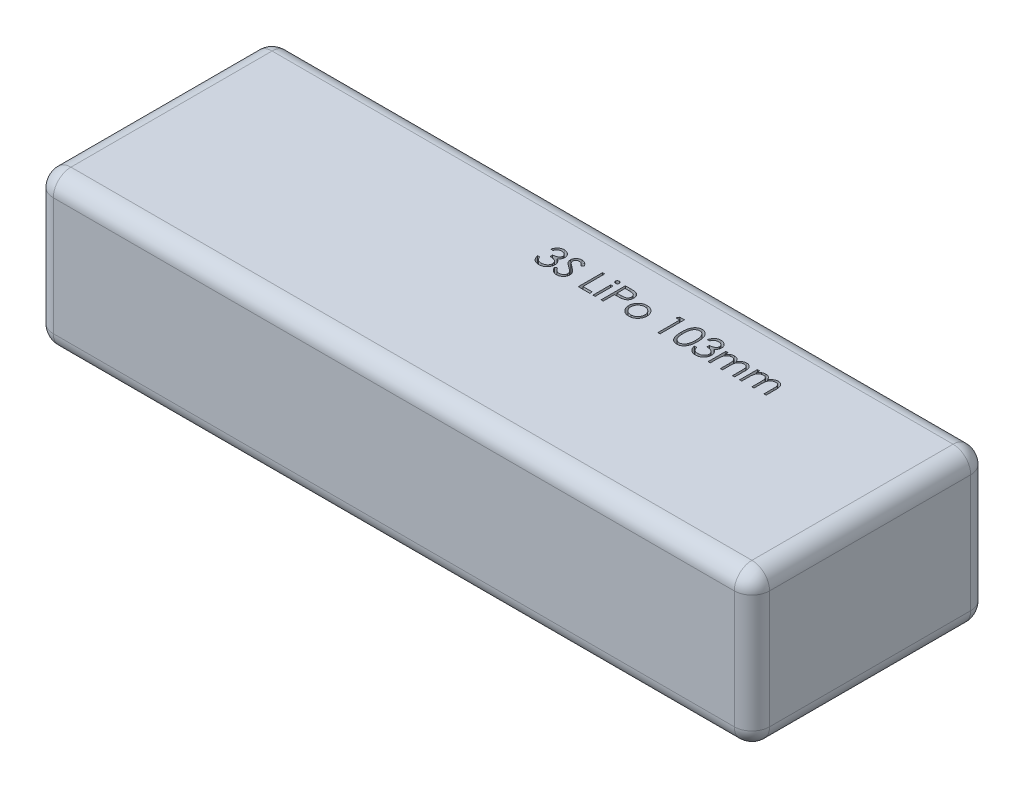
from build123d import *

# Parameters (mm, degrees)
SKETCH1_W           = 103
SKETCH1_H           = 34
BOSS_EXTRUDE1_DEPTH = 22
FILLET1_R           = 2.54
FILLET2_R           = 2.54
SKETCH2_W           = 0.314102564
SKETCH2_H           = 2.557692308
CUT_EXTRUDE1_DEPTH  = 2.54


with BuildPart() as part:
    # Sketch1 → Boss-Extrude1 (new body)
    with BuildSketch(Plane(origin=(0, 0, 0), x_dir=(1, 0, 0), z_dir=(0, 1, 0))):
        with Locations((51.5, 17)):
            Rectangle(SKETCH1_W, SKETCH1_H)
    extrude(amount=BOSS_EXTRUDE1_DEPTH)

    # Fillet1
    fillet1_edges = [part.edges().sort_by_distance(p)[0] for p in [
        (51.5, 22, -34),
        (51.5, 0, -34),
        (51.5, 0, 0),
        (51.5, 22, 0),
    ]]
    fillet(fillet1_edges, radius=FILLET1_R)

    # Fillet2
    fillet2_edges = [part.edges().sort_by_distance(p)[0] for p in [
        (103, 11, 0),
        (0, 11, 0),
        (103, 0, -17),
        (103, 11, -34),
        (103, 22, -17),
        (103, 21.256051224, -0.743948776),
        (103, 21.256051224, -33.256051224),
        (103, 0.743948776, -33.256051224),
        (103, 0.743948776, -0.743948776),
        (0, 0, -17),
        (0, 22, -17),
        (0, 11, -34),
        (0, 21.256051224, -0.743948776),
        (0, 21.256051224, -33.256051224),
        (0, 0.743948776, -33.256051224),
        (0, 0.743948776, -0.743948776),
    ]]
    fillet(fillet2_edges, radius=FILLET2_R)

    # Sketch2 → Cut-Extrude1 (cut)
    # profile 1 of 12: a face of its own
    with BuildSketch(Plane(origin=(0, 22, 0), x_dir=(1, 0, 0), z_dir=(0, 1, 0))):
        with BuildLine():
            Line((47.573333333, 26.822307692), (47.259230769, 26.822307692))
            add(Edge.make_bspline(
                [(47.259230769, 26.822307692), (47.26774032, 26.857540176), (47.284375795, 26.926416801), (47.319073369, 27.024824062), (47.356872624, 27.117947583), (47.402261729, 27.204043657), (47.451770483, 27.284842559), (47.508493204, 27.358511684), (47.569812927, 27.426924649), (47.637637876, 27.487637887), (47.708766538, 27.542615616), (47.784201158, 27.589490673), (47.862424051, 27.629814826), (47.943977184, 27.663035058), (48.029103356, 27.688060582), (48.117032979, 27.706217387), (48.207996479, 27.718008502), (48.26974407, 27.719159265), (48.301097756, 27.71974359)],
                knots=[0, 0, 0, 0, 1.162005537, 2.271625781, 3.343758855, 4.383309926, 5.390229558, 6.379919256, 7.361854164, 8.333198761, 9.295911338, 10.242430842, 11.177959212, 12.116337295, 13.062827104, 14.020064771, 14.994644689, 16, 16, 16, 16], degree=3))
            add(Edge.make_bspline(
                [(48.301097756, 27.71974359), (48.346780498, 27.718364359), (48.437149509, 27.715635984), (48.569912556, 27.690721548), (48.697939375, 27.651296415), (48.819828623, 27.596822688), (48.933047056, 27.529635375), (49.033783243, 27.449670638), (49.120671753, 27.358471337), (49.193566131, 27.257738772), (49.25064113, 27.150083263), (49.292727504, 27.039283106), (49.318349185, 26.925601134), (49.321669741, 26.848843855), (49.323333333, 26.810388622)],
                knots=[0, 0, 0, 0, 1.083050992, 2.142477498, 3.193116406, 4.255571735, 5.30263384, 6.308962982, 7.297363603, 8.282367274, 9.249857812, 10.179914175, 11.08814088, 12, 12, 12, 12], degree=3))
            add(Edge.make_bspline(
                [(49.323333333, 26.810388622), (49.322169742, 26.773381827), (49.319892775, 26.700965273), (49.30055907, 26.595243775), (49.268022807, 26.495602175), (49.222953044, 26.401621013), (49.164611494, 26.313896173), (49.093938797, 26.232230282), (49.010436135, 26.156261124), (48.947157197, 26.112741651), (48.914579327, 26.090336538)],
                knots=[0, 0, 0, 0, 1.024540389, 2.004866551, 2.965041327, 3.920577974, 4.882998113, 5.874504559, 6.905732034, 8, 8, 8, 8], degree=3))
            add(Edge.make_bspline(
                [(48.914579327, 26.090336538), (48.951811081, 26.072358367), (49.025577956, 26.036738409), (49.126128485, 25.966882652), (49.217406361, 25.886226304), (49.26831008, 25.823283652), (49.293886218, 25.791658654)],
                knots=[0, 0, 0, 0, 1.015518401, 2.012035669, 3.001164323, 4, 4, 4, 4], degree=3))
            add(Edge.make_bspline(
                [(49.293886218, 25.791658654), (49.31072756, 25.768600902), (49.344134456, 25.722862986), (49.38536999, 25.64932656), (49.422779104, 25.574975071), (49.451929324, 25.497815664), (49.474503191, 25.418742651), (49.490639223, 25.337620255), (49.500663364, 25.254382232), (49.502098916, 25.198069752), (49.502820513, 25.169763622)],
                knots=[0, 0, 0, 0, 1.025084078, 2.033381695, 3.024893161, 4.013698104, 4.991890475, 5.976764909, 6.982997093, 8, 8, 8, 8], degree=3))
            add(Edge.make_bspline(
                [(49.502820513, 25.169763622), (49.501025999, 25.120753901), (49.497445417, 25.022965099), (49.465441343, 24.878490377), (49.415828102, 24.737264875), (49.345371166, 24.602190036), (49.259503657, 24.475809655), (49.157346333, 24.362733346), (49.040059925, 24.265534741), (48.909254276, 24.184324513), (48.767537148, 24.119406591), (48.615961556, 24.074349148), (48.456711502, 24.045003148), (48.347504204, 24.04185628), (48.291983173, 24.04025641)],
                knots=[0, 0, 0, 0, 0.955779014, 1.907060117, 2.875433937, 3.871313158, 4.872415639, 5.851225146, 6.836215519, 7.83643374, 8.849228613, 9.86973379, 10.916971861, 12, 12, 12, 12], degree=3))
            add(Edge.make_bspline(
                [(48.291983173, 24.04025641), (48.254563873, 24.041124624), (48.180935168, 24.042832978), (48.072691669, 24.054511579), (47.96936997, 24.075841584), (47.870830372, 24.104544889), (47.776985336, 24.140936632), (47.688121231, 24.18625533), (47.603691337, 24.239566832), (47.524492386, 24.301500419), (47.450533818, 24.370781759), (47.383781094, 24.448640769), (47.323121301, 24.533638173), (47.270178662, 24.626761229), (47.22254171, 24.726806487), (47.183360753, 24.835054985), (47.148875184, 24.950539007), (47.13284172, 25.031016747), (47.124615385, 25.072307692)],
                knots=[0, 0, 0, 0, 1.048658725, 2.063410685, 3.046034179, 4.001477787, 4.936774919, 5.862367409, 6.792675028, 7.730719943, 8.675894397, 9.627829632, 10.600096036, 11.597688215, 12.626045268, 13.701542398, 14.82072376, 16, 16, 16, 16], degree=3))
            Line((47.124615385, 25.072307692), (47.438717949, 25.072307692))
            add(Edge.make_bspline(
                [(47.438717949, 25.072307692), (47.44690124, 25.045358679), (47.462818453, 24.992940507), (47.489912751, 24.917500202), (47.520781023, 24.848342149), (47.553895582, 24.784959027), (47.588674028, 24.726726624), (47.627588953, 24.675184755), (47.667758098, 24.628069553), (47.698037451, 24.601524941), (47.712856571, 24.588533654)],
                knots=[0, 0, 0, 0, 1.198163088, 2.33053128, 3.407730985, 4.417276592, 5.372219308, 6.28897303, 7.162600585, 8, 8, 8, 8], degree=3))
            add(Edge.make_bspline(
                [(47.712856571, 24.588533654), (47.732453147, 24.57342532), (47.77158581, 24.543255288), (47.835354041, 24.50475366), (47.902418927, 24.471392634), (47.974233601, 24.445908939), (48.049248372, 24.424331278), (48.128675737, 24.410210759), (48.211814954, 24.400522587), (48.268582718, 24.399667656), (48.297592147, 24.399230769)],
                knots=[0, 0, 0, 0, 0.946170439, 1.889420265, 2.845303464, 3.807233317, 4.801018734, 5.828864929, 6.890507805, 8, 8, 8, 8], degree=3))
            add(Edge.make_bspline(
                [(48.297592147, 24.399230769), (48.33034565, 24.399846674), (48.394392297, 24.401051024), (48.487847156, 24.412126731), (48.576754604, 24.428257144), (48.66012753, 24.453170127), (48.739058037, 24.483950979), (48.812439687, 24.522599384), (48.881235793, 24.567944106), (48.944565198, 24.619483264), (49.001510706, 24.675904759), (49.051650219, 24.73491783), (49.09427488, 24.79627366), (49.128658459, 24.860311781), (49.155809009, 24.92676701), (49.17429221, 24.995825839), (49.187143725, 25.066923105), (49.188190337, 25.115252074), (49.188717949, 25.139615385)],
                knots=[0, 0, 0, 0, 1.217147791, 2.380027433, 3.494444702, 4.572153297, 5.609568379, 6.639424714, 7.649109417, 8.668170816, 9.669597737, 10.625200337, 11.543417969, 12.441394052, 13.322311151, 14.205496177, 15.095365482, 16, 16, 16, 16], degree=3))
            add(Edge.make_bspline(
                [(49.188717949, 25.139615385), (49.187187647, 25.172226723), (49.184134659, 25.237287132), (49.160826079, 25.333004706), (49.122487215, 25.425228118), (49.068814704, 25.512383909), (49.003478975, 25.59315981), (48.927114068, 25.665231293), (48.83908584, 25.724701384), (48.758065971, 25.76579004), (48.686300814, 25.793827115), (48.62488543, 25.81250208), (48.556128827, 25.828315735), (48.480862478, 25.843028007), (48.398519261, 25.855549355), (48.309188823, 25.865991171), (48.212853062, 25.874346212), (48.146161896, 25.878077307), (48.111794872, 25.88)],
                knots=[0, 0, 0, 0, 1.07054697, 2.135767047, 3.216561865, 4.33974944, 5.486079747, 6.621378074, 7.775625952, 8.963672916, 9.598146892, 10.304877434, 11.070270905, 11.915000392, 12.823868403, 13.805723172, 14.86925407, 16, 16, 16, 16], degree=3))
            Line((48.111794872, 25.88), (48.111794872, 26.238974359))
            add(Edge.make_bspline(
                [(48.111794872, 26.238974359), (48.155096038, 26.239709163), (48.239912384, 26.241148463), (48.363806689, 26.258556473), (48.482280001, 26.282637101), (48.592706743, 26.319522293), (48.693355456, 26.36236259), (48.780675058, 26.4122148), (48.853442206, 26.467629549), (48.911303277, 26.529462158), (48.954832506, 26.595777206), (48.986659303, 26.664893864), (49.005459629, 26.737417924), (49.007969296, 26.786912592), (49.009230769, 26.811790865)],
                knots=[0, 0, 0, 0, 1.321986639, 2.589447074, 3.816329219, 5.01088745, 6.139805852, 7.153945165, 8.075214402, 8.924034688, 9.728124013, 10.488707548, 11.240355623, 12, 12, 12, 12], degree=3))
            add(Edge.make_bspline(
                [(49.009230769, 26.811790865), (49.008816358, 26.830068611), (49.007991907, 26.866431318), (48.99759463, 26.919556386), (48.981970589, 26.971057332), (48.960490859, 27.020715142), (48.931740661, 27.068185416), (48.897334674, 27.113872865), (48.856366574, 27.157516644), (48.809421127, 27.198196964), (48.759009322, 27.236966201), (48.703759547, 27.269879838), (48.645337672, 27.2980249), (48.583679017, 27.321234402), (48.518583487, 27.33869369), (48.450356929, 27.351229532), (48.378869246, 27.359067187), (48.330097514, 27.360195602), (48.305304487, 27.360769231)],
                knots=[0, 0, 0, 0, 0.884392785, 1.759457502, 2.611959086, 3.489218968, 4.37281399, 5.2945488, 6.255912374, 7.266815255, 8.301784654, 9.332968512, 10.37626691, 11.440494194, 12.520033166, 13.637162961, 14.798855837, 16, 16, 16, 16], degree=3))
            add(Edge.make_bspline(
                [(48.305304487, 27.360769231), (48.265452819, 27.359377869), (48.187613243, 27.356660215), (48.075398326, 27.332857202), (47.971078992, 27.294879118), (47.891340325, 27.249546099), (47.832457751, 27.204795665), (47.790380813, 27.165713279), (47.749060303, 27.122280455), (47.711214626, 27.07182208), (47.672940649, 27.017755289), (47.638096087, 26.957331608), (47.604236395, 26.892127214), (47.583833846, 26.846031579), (47.573333333, 26.822307692)],
                knots=[0, 0, 0, 0, 1.472543308, 2.876219568, 4.221790263, 5.565193594, 6.249813518, 6.953379497, 7.687249741, 8.463570142, 9.283606569, 10.136032583, 11.040678096, 12, 12, 12, 12], degree=3))
        make_face()
    # profile 2 of 12: a face of its own
    with BuildSketch(Plane(origin=(0, 22, 0), x_dir=(1, 0, 0), z_dir=(0, 1, 0))):
        with BuildLine():
            Line((49.772051282, 24.805180288), (50.067924679, 24.982564103))
            add(Edge.make_bspline(
                [(50.067924679, 24.982564103), (50.095442917, 24.936499718), (50.148166797, 24.848242134), (50.236118157, 24.728984093), (50.327251068, 24.627621937), (50.422240401, 24.544745329), (50.520506349, 24.479496442), (50.622690403, 24.433294211), (50.728448214, 24.404478235), (50.800422035, 24.400978149), (50.836354167, 24.399230769)],
                knots=[0, 0, 0, 0, 1.272034388, 2.437168799, 3.508375237, 4.49857839, 5.41946034, 6.295179144, 7.148887113, 8, 8, 8, 8], degree=3))
            add(Edge.make_bspline(
                [(50.836354167, 24.399230769), (50.867041027, 24.400085442), (50.9278778, 24.401779832), (51.017440043, 24.418060634), (51.104421845, 24.443072763), (51.187030483, 24.478893694), (51.264126098, 24.52223218), (51.331732793, 24.574578358), (51.390178906, 24.633184563), (51.437988021, 24.698567218), (51.474668056, 24.768884367), (51.502860124, 24.841060318), (51.518505198, 24.916228886), (51.520861952, 24.966839349), (51.522051282, 24.992379808)],
                knots=[0, 0, 0, 0, 1.095163259, 2.171163733, 3.241058638, 4.321873601, 5.38011039, 6.391990106, 7.366004449, 8.327778327, 9.272591725, 10.192022065, 11.087607919, 12, 12, 12, 12], degree=3))
            add(Edge.make_bspline(
                [(51.522051282, 24.992379808), (51.520576971, 25.021520657), (51.517579913, 25.080759747), (51.492248433, 25.1681594), (51.452399186, 25.25465197), (51.415636543, 25.308153235), (51.396550481, 25.335929487)],
                knots=[0, 0, 0, 0, 0.938893495, 1.908633276, 2.914225137, 4, 4, 4, 4], degree=3))
            add(Edge.make_bspline(
                [(51.396550481, 25.335929487), (51.380879867, 25.355976311), (51.347981372, 25.398062109), (51.29142386, 25.460707345), (51.225057745, 25.525325764), (51.15115419, 25.594384821), (51.067021102, 25.664672617), (50.975293587, 25.739540895), (50.873629728, 25.816142472), (50.802330232, 25.867515038), (50.765540865, 25.894022436)],
                knots=[0, 0, 0, 0, 0.722233717, 1.516239348, 2.393582979, 3.351407094, 4.387010283, 5.505090956, 6.712668013, 8, 8, 8, 8], degree=3))
            add(Edge.make_bspline(
                [(50.765540865, 25.894022436), (50.728716869, 25.920251024), (50.658312193, 25.970398086), (50.55985361, 26.04482237), (50.471809147, 26.112866239), (50.394570131, 26.175170251), (50.328170534, 26.231742856), (50.272087123, 26.282040795), (50.227748566, 26.327424356), (50.203092985, 26.356865698), (50.192023237, 26.370084135)],
                knots=[0, 0, 0, 0, 1.452282411, 2.77665338, 3.964542531, 5.026858415, 5.96415736, 6.766646006, 7.446254459, 8, 8, 8, 8], degree=3))
            add(Edge.make_bspline(
                [(50.192023237, 26.370084135), (50.176550692, 26.390685171), (50.146121855, 26.431199875), (50.10595585, 26.494524733), (50.071816687, 26.559347998), (50.045054355, 26.625843863), (50.022518136, 26.693078792), (50.007360205, 26.761930038), (49.997868808, 26.832088656), (49.996896822, 26.879302157), (49.996410256, 26.902936699)],
                knots=[0, 0, 0, 0, 1.068054152, 2.10047183, 3.106115577, 4.101338837, 5.06977816, 6.043150881, 7.020423561, 8, 8, 8, 8], degree=3))
            add(Edge.make_bspline(
                [(49.996410256, 26.902936699), (49.997715465, 26.939966473), (50.000297985, 27.013234537), (50.022138503, 27.120265367), (50.056611396, 27.222451785), (50.104906284, 27.318782118), (50.167163637, 27.406748099), (50.239209612, 27.487361586), (50.325021098, 27.555130168), (50.419173721, 27.614342227), (50.522230093, 27.660688152), (50.630220997, 27.695649132), (50.743318069, 27.71545839), (50.819921203, 27.718301155), (50.858790064, 27.71974359)],
                knots=[0, 0, 0, 0, 1.005424448, 1.989358655, 2.955360095, 3.929531133, 4.905563448, 5.876582895, 6.856512386, 7.866279853, 8.892233794, 9.918561126, 10.94386622, 12, 12, 12, 12], degree=3))
            add(Edge.make_bspline(
                [(50.858790064, 27.71974359), (50.900034164, 27.718321038), (50.982055516, 27.715492037), (51.102704732, 27.690894506), (51.218865448, 27.650193834), (51.312308713, 27.604005176), (51.385441474, 27.55787376), (51.441214207, 27.515853936), (51.497731658, 27.467478827), (51.555449713, 27.412619581), (51.613390372, 27.35077283), (51.672413824, 27.282362141), (51.732658093, 27.207805585), (51.771413953, 27.154581085), (51.791282051, 27.127295673)],
                knots=[0, 0, 0, 0, 1.286793592, 2.559021753, 3.825965368, 5.121522368, 5.803751409, 6.523245864, 7.299691795, 8.125521123, 9.008227632, 9.944561021, 10.946284179, 12, 12, 12, 12], degree=3))
            Line((51.791282051, 27.127295673), (51.507327724, 26.912051282))
            add(Edge.make_bspline(
                [(51.507327724, 26.912051282), (51.490181792, 26.934139972), (51.457162735, 26.976677626), (51.407033248, 27.036248941), (51.3597846, 27.090665421), (51.3132342, 27.137930549), (51.269840569, 27.180632682), (51.227723527, 27.217192439), (51.187489175, 27.247968034), (51.136772265, 27.280811594), (51.073054546, 27.313368098), (50.99307001, 27.340917176), (50.909483735, 27.357472238), (50.852554104, 27.359661126), (50.823733974, 27.360769231)],
                knots=[0, 0, 0, 0, 1.181633172, 2.275549214, 3.290209073, 4.226197932, 5.078386478, 5.862611352, 6.581680152, 7.217281963, 8.414376989, 9.595101626, 10.782541182, 12, 12, 12, 12], degree=3))
            add(Edge.make_bspline(
                [(50.823733974, 27.360769231), (50.787577452, 27.359557531), (50.717853005, 27.357220882), (50.618862768, 27.331700896), (50.529768843, 27.291519036), (50.453216278, 27.235204058), (50.389479301, 27.168483065), (50.343373843, 27.09170421), (50.315623678, 27.006921808), (50.312237398, 26.947780151), (50.310512821, 26.917660256)],
                knots=[0, 0, 0, 0, 1.14458467, 2.207223713, 3.21896685, 4.227309161, 5.202851033, 6.127160689, 7.046193047, 8, 8, 8, 8], degree=3))
            add(Edge.make_bspline(
                [(50.310512821, 26.917660256), (50.310905947, 26.898908778), (50.311692843, 26.861375158), (50.322667641, 26.805923736), (50.33676697, 26.750612397), (50.359109602, 26.695689814), (50.389954905, 26.640195455), (50.430460081, 26.583173718), (50.481473393, 26.524122009), (50.520550406, 26.485714635), (50.541181891, 26.465436699)],
                knots=[0, 0, 0, 0, 0.858281714, 1.717966888, 2.583508476, 3.4729293, 4.427298488, 5.488583878, 6.674047936, 8, 8, 8, 8], degree=3))
            add(Edge.make_bspline(
                [(50.541181891, 26.465436699), (50.548843263, 26.458599673), (50.567044931, 26.442356465), (50.600320856, 26.415764184), (50.644263655, 26.382961412), (50.697725856, 26.342374095), (50.761693217, 26.295292633), (50.836172774, 26.242319021), (50.920334306, 26.181733562), (50.980056222, 26.139376021), (51.011634615, 26.116979167)],
                knots=[0, 0, 0, 0, 0.420754252, 0.999615792, 1.744751191, 2.668019286, 3.750313428, 4.999500688, 6.413464383, 8, 8, 8, 8], degree=3))
            add(Edge.make_bspline(
                [(51.011634615, 26.116979167), (51.049620529, 26.089337807), (51.123174985, 26.035814145), (51.227832565, 25.955398465), (51.322726373, 25.876750697), (51.408189577, 25.80037309), (51.485066485, 25.726844997), (51.552504206, 25.655281816), (51.611189886, 25.586196244), (51.674369105, 25.497623668), (51.738926924, 25.388842584), (51.794368432, 25.255564345), (51.829326779, 25.121768025), (51.833898294, 25.031841188), (51.836153846, 24.987471955)],
                knots=[0, 0, 0, 0, 1.163667725, 2.253281268, 3.268753668, 4.215851969, 5.092017293, 5.902905408, 6.650798638, 7.335211899, 8.59617414, 9.77448103, 10.901945474, 12, 12, 12, 12], degree=3))
            add(Edge.make_bspline(
                [(51.836153846, 24.987471955), (51.835496708, 24.95609359), (51.834195193, 24.893946206), (51.819234279, 24.80269113), (51.797314614, 24.71406026), (51.76427738, 24.629149147), (51.723954222, 24.546404385), (51.672787974, 24.467996484), (51.613480289, 24.392190086), (51.545446524, 24.321006594), (51.471000622, 24.255660398), (51.392316927, 24.197531337), (51.309266654, 24.149063014), (51.222300338, 24.109512172), (51.131398001, 24.078578654), (51.036590217, 24.056165785), (50.937720706, 24.042410074), (50.870520224, 24.040982313), (50.836354167, 24.04025641)],
                knots=[0, 0, 0, 0, 0.983748083, 1.948392443, 2.894712957, 3.844097841, 4.80183111, 5.778335162, 6.776009319, 7.81870978, 8.863265674, 9.881300176, 10.883814829, 11.87499822, 12.874611388, 13.892143829, 14.928324115, 16, 16, 16, 16], degree=3))
            add(Edge.make_bspline(
                [(50.836354167, 24.04025641), (50.809918824, 24.040767592), (50.757381064, 24.041783517), (50.679671582, 24.050764798), (50.603531993, 24.063471901), (50.529917711, 24.083645971), (50.457880299, 24.108122948), (50.387733064, 24.138261281), (50.319442011, 24.174378482), (50.252624428, 24.215673507), (50.187450253, 24.263731252), (50.124530785, 24.319704748), (50.0618016, 24.382050253), (50.001114203, 24.452460816), (49.941241059, 24.529798899), (49.883362649, 24.614788083), (49.826280932, 24.706965436), (49.790465464, 24.771830522), (49.772051282, 24.805180288)],
                knots=[0, 0, 0, 0, 0.915332311, 1.819136955, 2.706846663, 3.586547465, 4.459518054, 5.340707479, 6.227863349, 7.133153174, 8.059268498, 9.028702269, 10.047606654, 11.120612155, 12.245963614, 13.433783089, 14.680604001, 16, 16, 16, 16], degree=3))
        make_face()
    # profile 3 of 12: a face of its own
    with BuildSketch(Plane(origin=(0, 22, 0), x_dir=(1, 0, 0), z_dir=(0, 1, 0))):
        Polygon((53.90025641, 27.63), (54.214358974, 27.63), (54.214358974, 24.488974359), (55.560512821, 24.488974359), (55.560512821, 24.13), (53.90025641, 24.13), align=None)
    # profile 4 of 12: a face of its own
    with BuildSketch(Plane(origin=(0, 22, 0), x_dir=(1, 0, 0), z_dir=(0, 1, 0))):
        with BuildLine():
            add(Edge.make_bspline(
                [(56.164879808, 27.764615385), (56.184371123, 27.763711232), (56.222538863, 27.761940728), (56.277732131, 27.746779251), (56.327989143, 27.721079566), (56.372566876, 27.686599885), (56.410818763, 27.646050441), (56.437599473, 27.598789473), (56.454811869, 27.547730834), (56.456890424, 27.512115745), (56.457948718, 27.493982372)],
                knots=[0, 0, 0, 0, 1.055194115, 2.066272739, 3.074728998, 4.095836921, 5.109056067, 6.073838105, 7.019297344, 8, 8, 8, 8], degree=3))
            add(Edge.make_bspline(
                [(56.457948718, 27.493982372), (56.456866558, 27.476319719), (56.454727256, 27.441402744), (56.437612768, 27.391229272), (56.41059053, 27.344624988), (56.372591404, 27.304154278), (56.327982643, 27.269693658), (56.277733858, 27.243988919), (56.222538409, 27.228828782), (56.18437097, 27.227058093), (56.164879808, 27.226153846)],
                knots=[0, 0, 0, 0, 0.96129708, 1.900370562, 2.859976407, 3.87933698, 4.906634145, 5.921202961, 6.938410037, 8, 8, 8, 8], degree=3))
            add(Edge.make_bspline(
                [(56.164879808, 27.226153846), (56.145611533, 27.227023566), (56.108108352, 27.228716363), (56.05374151, 27.244286381), (56.003913021, 27.269702454), (55.959248348, 27.303928639), (55.922018155, 27.344873536), (55.894919829, 27.39120083), (55.877844868, 27.441409985), (55.875700239, 27.476322151), (55.874615385, 27.493982372)],
                knots=[0, 0, 0, 0, 1.054934014, 2.053291228, 3.073705704, 4.106921865, 5.123545215, 6.088680038, 7.033164197, 8, 8, 8, 8], degree=3))
            add(Edge.make_bspline(
                [(55.874615385, 27.493982372), (55.875676471, 27.512113221), (55.877760512, 27.547723354), (55.894932628, 27.598818387), (55.921792436, 27.645799889), (55.959273, 27.686825388), (56.00390646, 27.721070823), (56.053743205, 27.746481804), (56.108107905, 27.762053144), (56.145611381, 27.763745758), (56.164879808, 27.764615385)],
                knots=[0, 0, 0, 0, 0.98631895, 1.937192651, 2.907499808, 3.917963147, 4.944918757, 5.95915025, 6.951458133, 8, 8, 8, 8], degree=3))
        make_face()
    # profile 5 of 12: a face of its own
    with BuildSketch(Plane(origin=(0, 22, 0), x_dir=(1, 0, 0), z_dir=(0, 1, 0))):
        with Locations((56.166282051, 25.408846154)):
            Rectangle(SKETCH2_W, SKETCH2_H)
    # profile 6 of 12: a face of its own
    with BuildSketch(Plane(origin=(0, 22, 0), x_dir=(1, 0, 0), z_dir=(0, 1, 0))):
        with BuildLine():
            Line((57.175897436, 27.63), (57.862295673, 27.63))
            add(Edge.make_bspline(
                [(57.862295673, 27.63), (57.909506579, 27.629948104), (57.999964772, 27.629848668), (58.129679828, 27.626833922), (58.247489559, 27.62280723), (58.35313994, 27.617225337), (58.446956038, 27.610628747), (58.528513338, 27.601376708), (58.598452894, 27.591716412), (58.640359344, 27.581895005), (58.659471154, 27.577415865)],
                knots=[0, 0, 0, 0, 1.415646017, 2.712440637, 3.8905458, 4.950247383, 5.884950622, 6.709939814, 7.411656543, 8, 8, 8, 8], degree=3))
            add(Edge.make_bspline(
                [(58.659471154, 27.577415865), (58.683664688, 27.570793916), (58.731481665, 27.557706054), (58.800382708, 27.53149233), (58.865936553, 27.500410165), (58.928368112, 27.464986225), (58.986910195, 27.423700661), (59.042436236, 27.378227043), (59.094456216, 27.327515475), (59.142677608, 27.272134735), (59.186962406, 27.213014525), (59.225092088, 27.149272295), (59.257019315, 27.081980992), (59.284402587, 27.011187421), (59.304111041, 26.936297097), (59.318957941, 26.857830385), (59.328381569, 26.775795695), (59.32928413, 26.719735827), (59.32974359, 26.691197917)],
                knots=[0, 0, 0, 0, 0.999701418, 1.975846123, 2.934577507, 3.890451536, 4.834027766, 5.787354733, 6.749476667, 7.726910423, 8.712836071, 9.690891519, 10.682875813, 11.679750201, 12.712814741, 13.765529915, 14.8625177, 16, 16, 16, 16], degree=3))
            add(Edge.make_bspline(
                [(59.32974359, 26.691197917), (59.329322165, 26.66242014), (59.328497619, 26.606114476), (59.318601334, 26.523741688), (59.305271142, 26.445023298), (59.28477409, 26.370133847), (59.257928417, 26.299518077), (59.226436364, 26.232096845), (59.188452833, 26.169017173), (59.144808004, 26.110050055), (59.096256409, 26.055140143), (59.043003471, 26.004685348), (58.985264179, 25.95898101), (58.923222031, 25.917924666), (58.856272182, 25.882468387), (58.785430028, 25.850711082), (58.710079812, 25.824040021), (58.657937298, 25.81000996), (58.631426282, 25.802876603)],
                knots=[0, 0, 0, 0, 1.121902311, 2.195077645, 3.232258892, 4.234102512, 5.217864754, 6.176164875, 7.132989551, 8.084763148, 9.034132444, 9.988522005, 10.94243251, 11.903244335, 12.886203696, 13.894208494, 14.929344452, 16, 16, 16, 16], degree=3))
            add(Edge.make_bspline(
                [(58.631426282, 25.802876603), (58.609498948, 25.798213621), (58.561443921, 25.787994427), (58.482301199, 25.77658597), (58.390155813, 25.76684837), (58.285133533, 25.759547232), (58.167328628, 25.753296864), (58.03667737, 25.74832877), (57.892923293, 25.745598916), (57.792652049, 25.745458123), (57.740300481, 25.745384615)],
                knots=[0, 0, 0, 0, 0.601384939, 1.31797006, 2.144135048, 3.087295005, 4.142315834, 5.309527816, 6.595305764, 8, 8, 8, 8], degree=3))
            Line((57.740300481, 25.745384615), (57.49, 25.745384615))
            Line((57.49, 25.745384615), (57.49, 24.13))
            Line((57.49, 24.13), (57.175897436, 24.13))
            Line((57.175897436, 24.13), (57.175897436, 27.63))
        make_face()
        with BuildLine():
            Line((57.49, 27.271025641), (57.49, 26.104358974))
            Line((57.49, 26.104358974), (58.102780449, 26.096646635))
            add(Edge.make_bspline(
                [(58.102780449, 26.096646635), (58.132700375, 26.096631171), (58.190460174, 26.096601319), (58.273896398, 26.100586542), (58.351305685, 26.105187075), (58.42245026, 26.111922998), (58.487362195, 26.121444256), (58.546149724, 26.131055994), (58.598357007, 26.144961356), (58.659456208, 26.163684426), (58.727539556, 26.195617041), (58.801607104, 26.241966931), (58.864377691, 26.30104764), (58.918695988, 26.367475471), (58.961801865, 26.4413746), (58.993357858, 26.520443537), (59.011899015, 26.603871387), (59.014385209, 26.660959525), (59.015641026, 26.689795673)],
                knots=[0, 0, 0, 0, 1.160613943, 2.240541288, 3.23993089, 4.169200891, 5.011653406, 5.7853311, 6.478053781, 7.106038997, 8.262395093, 9.384106736, 10.481365981, 11.59014053, 12.70357646, 13.786202915, 14.881775077, 16, 16, 16, 16], degree=3))
            add(Edge.make_bspline(
                [(59.015641026, 26.689795673), (59.014378379, 26.717934187), (59.011868394, 26.773870069), (58.993212531, 26.855848829), (58.961863217, 26.934084534), (58.918406623, 27.007057619), (58.865665493, 27.073246423), (58.80436615, 27.13074355), (58.734652888, 27.176965253), (58.669804657, 27.206798534), (58.612203471, 27.22501381), (58.562171511, 27.23775865), (58.505680837, 27.247934257), (58.442713057, 27.256173759), (58.373756223, 27.263227221), (58.298217909, 27.268013198), (58.216384265, 27.270814654), (58.159573694, 27.270953609), (58.130124199, 27.271025641)],
                knots=[0, 0, 0, 0, 1.120700087, 2.227813068, 3.331159281, 4.466773991, 5.599788987, 6.693661531, 7.80175334, 8.91857717, 9.525282508, 10.207424825, 10.974604443, 11.810962634, 12.737642355, 13.736264703, 14.826523623, 16, 16, 16, 16], degree=3))
            Line((58.130124199, 27.271025641), (57.49, 27.271025641))
        make_face(mode=Mode.SUBTRACT)
    # profile 7 of 12: a face of its own
    with BuildSketch(Plane(origin=(0, 22, 0), x_dir=(1, 0, 0), z_dir=(0, 1, 0))):
        with BuildLine():
            add(Edge.make_bspline(
                [(61.193325321, 26.732564103), (61.241316593, 26.731542211), (61.335415751, 26.729538533), (61.473223637, 26.708123567), (61.604768773, 26.675376203), (61.730554965, 26.630104641), (61.84897126, 26.56942269), (61.961742504, 26.497013399), (62.068559513, 26.411230805), (62.132582543, 26.344872737), (62.165080128, 26.311189904)],
                knots=[0, 0, 0, 0, 1.054011418, 2.066658804, 3.057071809, 4.030435133, 4.997543892, 5.974964718, 6.972108034, 8, 8, 8, 8], degree=3))
            add(Edge.make_bspline(
                [(62.165080128, 26.311189904), (62.193062082, 26.278975918), (62.248484463, 26.215171376), (62.319550181, 26.111715763), (62.380771741, 26.004575662), (62.429834702, 25.892328336), (62.468519726, 25.775953664), (62.495985422, 25.655051653), (62.512322357, 25.529889306), (62.514525324, 25.444885468), (62.515641026, 25.401834936)],
                knots=[0, 0, 0, 0, 1.025258237, 2.030674902, 3.01204498, 3.988269485, 4.97094183, 5.956517959, 6.965070386, 8, 8, 8, 8], degree=3))
            add(Edge.make_bspline(
                [(62.515641026, 25.401834936), (62.514659688, 25.358534878), (62.51272052, 25.272971945), (62.494376904, 25.146952579), (62.465845818, 25.024757756), (62.42501398, 24.906899063), (62.37265587, 24.793016235), (62.308765183, 24.683606686), (62.232893566, 24.578454553), (62.146889569, 24.478452714), (62.051837693, 24.3862865), (61.948721544, 24.30595823), (61.839567511, 24.237136706), (61.722924157, 24.18170029), (61.599856671, 24.13799059), (61.470099602, 24.107290573), (61.333854532, 24.08872889), (61.240827311, 24.086345316), (61.193325321, 24.085128205)],
                knots=[0, 0, 0, 0, 0.998656419, 1.973391657, 2.932242238, 3.890759089, 4.846373663, 5.82037756, 6.809684879, 7.83454468, 8.860553229, 9.859544525, 10.845671541, 11.83227036, 12.833544569, 13.85385346, 14.904124723, 16, 16, 16, 16], degree=3))
            add(Edge.make_bspline(
                [(61.193325321, 24.085128205), (61.145590601, 24.086349401), (61.052099741, 24.088741176), (60.915373759, 24.107218459), (60.78538414, 24.137976441), (60.662155542, 24.181843934), (60.545010695, 24.237138478), (60.435224198, 24.305750167), (60.332024282, 24.386310322), (60.236952298, 24.478446259), (60.150953693, 24.578456216), (60.075080684, 24.683606254), (60.011190358, 24.793016348), (59.958832154, 24.906899033), (59.918000341, 25.024757764), (59.889469249, 25.146952577), (59.871125634, 25.272971945), (59.869186466, 25.358534878), (59.868205128, 25.401834936)],
                knots=[0, 0, 0, 0, 1.099876186, 2.154163076, 3.173186993, 4.173200201, 5.163417411, 6.152872554, 7.150605724, 8.17532212, 9.198891216, 10.186952605, 11.159729845, 12.11414092, 13.071450619, 14.029093627, 15.002601286, 16, 16, 16, 16], degree=3))
            add(Edge.make_bspline(
                [(59.868205128, 25.401834936), (59.869328439, 25.444651482), (59.8715524, 25.529420884), (59.887872909, 25.654347945), (59.915231466, 25.775045334), (59.953962862, 25.89097081), (60.003478053, 26.002726246), (60.063839341, 26.110131077), (60.135629973, 26.213118877), (60.190831925, 26.276840957), (60.218766026, 26.309086538)],
                knots=[0, 0, 0, 0, 1.031353054, 2.041901799, 3.029428768, 4.008703097, 4.981709435, 5.96992636, 6.972712378, 8, 8, 8, 8], degree=3))
            add(Edge.make_bspline(
                [(60.218766026, 26.309086538), (60.251214617, 26.343061478), (60.315030481, 26.409879174), (60.422379208, 26.495411698), (60.534873029, 26.569327772), (60.654597955, 26.628803987), (60.780280813, 26.675642505), (60.912500056, 26.70820802), (61.050775571, 26.729461375), (61.145335193, 26.731519553), (61.193325321, 26.732564103)],
                knots=[0, 0, 0, 0, 1.027980169, 2.021703884, 2.998553061, 3.971491411, 4.943284454, 5.930300938, 6.949603206, 8, 8, 8, 8], degree=3))
        make_face()
        with BuildLine():
            add(Edge.make_bspline(
                [(61.191923077, 26.418461538), (61.157985466, 26.417496947), (61.090986337, 26.415592664), (60.992366752, 26.40110876), (60.897426598, 26.378161255), (60.805985754, 26.345557199), (60.718352582, 26.3034583), (60.634443179, 26.25174994), (60.554010739, 26.191116984), (60.478628676, 26.121654312), (60.409446364, 26.045775317), (60.348968387, 25.964926959), (60.297543281, 25.880420612), (60.254703122, 25.792168401), (60.222795934, 25.699275987), (60.199622911, 25.602795356), (60.185152671, 25.50252994), (60.183266292, 25.434368921), (60.182307692, 25.399731571)],
                knots=[0, 0, 0, 0, 1.021534396, 2.016698045, 2.994645724, 3.958388632, 4.93408049, 5.916473867, 6.921342795, 7.962252576, 8.998418191, 10.008913653, 10.997312074, 11.973003931, 12.956656626, 13.948281152, 14.957379055, 16, 16, 16, 16], degree=3))
            add(Edge.make_bspline(
                [(60.182307692, 25.399731571), (60.183914516, 25.354979543), (60.18710376, 25.266155138), (60.213038997, 25.135344015), (60.256425277, 25.009762163), (60.315012556, 24.890145777), (60.388418775, 24.779473499), (60.474905842, 24.680802015), (60.573545542, 24.595616203), (60.683162042, 24.524935358), (60.80151636, 24.468775602), (60.926772681, 24.428976626), (61.057413375, 24.403104934), (61.146694107, 24.400533459), (61.191923077, 24.399230769)],
                knots=[0, 0, 0, 0, 1.016792936, 2.018143844, 3.017858371, 4.030088057, 5.03801393, 6.028138512, 7.003788237, 7.991172063, 8.984598303, 9.972568034, 10.972917682, 12, 12, 12, 12], degree=3))
            add(Edge.make_bspline(
                [(61.191923077, 24.399230769), (61.237149446, 24.400541049), (61.326425042, 24.403127506), (61.456884219, 24.428846326), (61.581798191, 24.468949987), (61.700029578, 24.524872197), (61.809596181, 24.595884611), (61.908945303, 24.680320988), (61.994693914, 24.77973484), (62.068027519, 24.890292369), (62.127574262, 25.009576721), (62.170757463, 25.135367193), (62.196755049, 25.266149235), (62.199935878, 25.354977566), (62.201538462, 25.399731571)],
                knots=[0, 0, 0, 0, 1.02726834, 2.027799167, 3.010890988, 4.004497153, 4.992059811, 5.971914811, 6.958719428, 7.966827853, 8.981595046, 9.981490638, 10.983022906, 12, 12, 12, 12], degree=3))
            add(Edge.make_bspline(
                [(62.201538462, 25.399731571), (62.200580192, 25.434369128), (62.198694462, 25.502530554), (62.184219498, 25.602793007), (62.161063958, 25.699284604), (62.129092341, 25.792136607), (62.086438327, 25.880649112), (62.034021534, 25.964678839), (61.973790509, 26.046055385), (61.903773388, 26.121409026), (61.82847001, 26.191144062), (61.748004972, 26.251773452), (61.664219993, 26.303231047), (61.576841411, 26.345917288), (61.485388843, 26.377864628), (61.390581714, 26.401241259), (61.292382904, 26.415531456), (61.225623861, 26.417478598), (61.191923077, 26.418461538)],
                knots=[0, 0, 0, 0, 1.042956736, 2.052379634, 3.044323526, 4.02829302, 5.004299113, 5.996692471, 7.007513377, 8.048758398, 9.090003419, 10.095195979, 11.07790575, 12.047570684, 13.018257071, 13.989683339, 14.985167495, 16, 16, 16, 16], degree=3))
        make_face(mode=Mode.SUBTRACT)
    # profile 8 of 12: a face of its own
    with BuildSketch(Plane(origin=(0, 22, 0), x_dir=(1, 0, 0), z_dir=(0, 1, 0))):
        Polygon((65.00953125, 27.63), (65.656666667, 27.63), (65.656666667, 24.13), (65.342564103, 24.13), (65.342564103, 27.271025641), (64.804102564, 27.271025641), align=None)
    # profile 9 of 12: a face of its own
    with BuildSketch(Plane(origin=(0, 22, 0), x_dir=(1, 0, 0), z_dir=(0, 1, 0))):
        with BuildLine():
            add(Edge.make_bspline(
                [(66.957948718, 25.878597756), (66.958276736, 25.934695144), (66.958913916, 26.043665128), (66.966002337, 26.20244977), (66.977777679, 26.351410059), (66.993915052, 26.490553125), (67.013553032, 26.61991489), (67.039768519, 26.739149647), (67.069581322, 26.848809254), (67.104133767, 26.949251302), (67.143121556, 27.041829005), (67.185555817, 27.128254207), (67.233120612, 27.208396139), (67.283097525, 27.283533929), (67.337509596, 27.352437624), (67.394808387, 27.416080287), (67.457230263, 27.472991037), (67.522653271, 27.524837339), (67.591669736, 27.570286811), (67.662312402, 27.61031955), (67.735067508, 27.644519417), (67.81013369, 27.671409853), (67.886836248, 27.6936207), (67.965443315, 27.708809647), (68.046084679, 27.718366556), (68.100516114, 27.719280224), (68.128120994, 27.71974359)],
                knots=[0, 0, 0, 0, 1.646270934, 3.197905019, 4.663502075, 6.030701355, 7.308322542, 8.50163776, 9.611534131, 10.641858119, 11.616356847, 12.558055219, 13.465016945, 14.349605745, 15.204443733, 16.039544428, 16.859896111, 17.680448484, 18.487036065, 19.28249412, 20.06191084, 20.843045899, 21.620316918, 22.403196591, 23.190181807, 24, 24, 24, 24], degree=3))
            add(Edge.make_bspline(
                [(68.128120994, 27.71974359), (68.155956472, 27.719255775), (68.211312481, 27.718285664), (68.293152856, 27.708961721), (68.373102538, 27.693490598), (68.450820677, 27.671569623), (68.526945663, 27.644373947), (68.600882071, 27.61028683), (68.673089152, 27.570607962), (68.74241944, 27.523984085), (68.809634055, 27.472001809), (68.873082018, 27.41323914), (68.932769104, 27.348289421), (68.98944441, 27.277847557), (69.041500007, 27.200562472), (69.091073439, 27.117778362), (69.135445475, 27.028047497), (69.17818015, 26.93286703), (69.215067137, 26.829603371), (69.248333382, 26.71883861), (69.275212351, 26.599264423), (69.297601623, 26.471508178), (69.314946519, 26.335100695), (69.327579161, 26.190334379), (69.334252246, 26.037113989), (69.335508947, 25.93235614), (69.336153846, 25.878597756)],
                knots=[0, 0, 0, 0, 0.810914788, 1.612654377, 2.396697861, 3.181598691, 3.963628158, 4.749916497, 5.551656086, 6.361998678, 7.18212741, 8.025565596, 8.878627764, 9.750805457, 10.657531673, 11.591944965, 12.560506719, 13.57287815, 14.630710178, 15.753379473, 16.941251878, 18.199788006, 19.531962791, 20.947069417, 22.433333509, 24, 24, 24, 24], degree=3))
            add(Edge.make_bspline(
                [(69.336153846, 25.878597756), (69.335502262, 25.825073848), (69.334232676, 25.720784697), (69.327653969, 25.568253721), (69.314695338, 25.424255678), (69.298485349, 25.288445216), (69.276034386, 25.161387597), (69.24842922, 25.042643148), (69.217778897, 24.931699077), (69.179944103, 24.829464265), (69.138533393, 24.734512542), (69.093478197, 24.645845394), (69.045208371, 24.562679101), (68.992619626, 24.485679354), (68.936566212, 24.414300697), (68.875848424, 24.349803074), (68.812177839, 24.290632402), (68.744765423, 24.237980775), (68.674353872, 24.19189597), (68.602394795, 24.15068212), (68.527611411, 24.117449425), (68.451698459, 24.088914384), (68.373570092, 24.067113932), (68.293323702, 24.052040077), (68.211367466, 24.041468228), (68.155965901, 24.040661748), (68.128120994, 24.04025641)],
                knots=[0, 0, 0, 0, 1.561518951, 3.042555995, 4.452378317, 5.7783523, 7.031515105, 8.214008947, 9.334062868, 10.386615937, 11.391082383, 12.354592575, 13.286541444, 14.194233754, 15.072674879, 15.931287219, 16.775624067, 17.606195743, 18.42308326, 19.229000347, 20.022332153, 20.807536673, 21.593273796, 22.3848459, 23.188221202, 24, 24, 24, 24], degree=3))
            add(Edge.make_bspline(
                [(68.128120994, 24.04025641), (68.10051688, 24.040722766), (68.046086955, 24.041642328), (67.965434529, 24.051156059), (67.887152086, 24.066451562), (67.810853332, 24.087868166), (67.736146817, 24.114083003), (67.66405053, 24.148236686), (67.593762846, 24.187570755), (67.52547129, 24.232366177), (67.460459129, 24.28368786), (67.398360524, 24.340452149), (67.340735505, 24.40407556), (67.287101409, 24.473553483), (67.236127321, 24.548246725), (67.189237948, 24.629175098), (67.145867094, 24.716017709), (67.106223603, 24.80933562), (67.07107494, 24.910490547), (67.040027232, 25.020639726), (67.015513074, 25.140755362), (66.994530119, 25.269872729), (66.977605736, 25.408546659), (66.96605141, 25.556852438), (66.958910095, 25.714697647), (66.958275025, 25.822967421), (66.957948718, 25.878597756)],
                knots=[0, 0, 0, 0, 0.810891512, 1.598919785, 2.382837074, 3.152667961, 3.926044502, 4.706494248, 5.493654104, 6.291793342, 7.103789334, 7.925228297, 8.761435821, 9.622817696, 10.50288917, 11.416980706, 12.369136599, 13.353924996, 14.394355917, 15.514179734, 16.714354668, 17.994756427, 19.357759367, 20.818452758, 22.365282078, 24, 24, 24, 24], degree=3))
        make_face()
        with BuildLine():
            add(Edge.make_bspline(
                [(67.272051282, 25.88), (67.272170729, 25.833251301), (67.272402552, 25.742521256), (67.278458753, 25.610677995), (67.286708985, 25.487707667), (67.297350282, 25.37345413), (67.313153231, 25.268304118), (67.330860019, 25.171534435), (67.352408108, 25.083657197), (67.377903126, 25.004069387), (67.406942223, 24.931420318), (67.438648087, 24.863819103), (67.472708809, 24.800467167), (67.51082796, 24.741933558), (67.552343023, 24.688027394), (67.596316282, 24.637794562), (67.644388867, 24.592997581), (67.710892609, 24.539270726), (67.798689084, 24.483751592), (67.909309539, 24.435405502), (68.02297799, 24.405023046), (68.10012924, 24.40115929), (68.138637821, 24.399230769)],
                knots=[0, 0, 0, 0, 1.459021318, 2.831673884, 4.118529203, 5.306027144, 6.411944654, 7.436330062, 8.375795394, 9.233974572, 10.042671642, 10.816086306, 11.563610507, 12.285937304, 12.993564865, 13.685989202, 14.367179055, 15.041617293, 16.353048772, 17.594441528, 18.799311195, 20, 20, 20, 20], degree=3))
            add(Edge.make_bspline(
                [(68.138637821, 24.399230769), (68.177395492, 24.40082855), (68.254830815, 24.404020813), (68.36796461, 24.43481955), (68.477794881, 24.48128909), (68.563866821, 24.536236595), (68.629349364, 24.588564925), (68.676266354, 24.633179573), (68.719328403, 24.68313544), (68.760170478, 24.737034736), (68.797629553, 24.79590722), (68.831692691, 24.859469796), (68.862776039, 24.927898973), (68.880485085, 24.975668713), (68.889539263, 25.000092147)],
                knots=[0, 0, 0, 0, 1.353760809, 2.704726607, 4.075137775, 5.516104923, 6.260822281, 7.007110065, 7.778089737, 8.566572457, 9.372053459, 10.217411131, 11.088608312, 12, 12, 12, 12], degree=3))
            add(Edge.make_bspline(
                [(68.889539263, 25.000092147), (68.900091031, 25.031321887), (68.921515644, 25.094731651), (68.949127419, 25.193095303), (68.970872818, 25.296298067), (68.990436184, 25.403723184), (69.00378924, 25.516162885), (69.014537053, 25.633269269), (69.02086774, 25.755130631), (69.021652491, 25.837925622), (69.022051282, 25.88)],
                knots=[0, 0, 0, 0, 0.884706709, 1.796334032, 2.740027952, 3.714592787, 4.726048262, 5.777819803, 6.87074269, 8, 8, 8, 8], degree=3))
            add(Edge.make_bspline(
                [(69.022051282, 25.88), (69.021501093, 25.922067573), (69.020424805, 26.004360737), (69.016310817, 26.124878918), (69.005687243, 26.239346679), (68.993888124, 26.348257152), (68.976490903, 26.451007454), (68.957733096, 26.548457759), (68.932531884, 26.639400784), (68.905612109, 26.725260366), (68.874801713, 26.805061021), (68.840885979, 26.879174807), (68.80466422, 26.947959532), (68.76532198, 27.011226473), (68.723326297, 27.069259016), (68.677568747, 27.120893611), (68.629864375, 27.167730579), (68.563047189, 27.221193148), (68.475572899, 27.275704843), (68.366727252, 27.325870603), (68.253456607, 27.354678896), (68.176883153, 27.358740583), (68.138637821, 27.360769231)],
                knots=[0, 0, 0, 0, 1.31362396, 2.569729283, 3.763502607, 4.902122613, 5.988968491, 7.01645872, 7.998833611, 8.933434873, 9.825090667, 10.667526885, 11.477055099, 12.250526234, 12.991942729, 13.710640831, 14.402115721, 15.076753259, 16.378508321, 17.609869233, 18.806226677, 20, 20, 20, 20], degree=3))
            add(Edge.make_bspline(
                [(68.138637821, 27.360769231), (68.099927228, 27.358737784), (68.022435523, 27.35467119), (67.907987568, 27.325977936), (67.798283216, 27.27596497), (67.711040242, 27.221012598), (67.644176455, 27.168674287), (67.597093762, 27.123287833), (67.55294759, 27.073641578), (67.51227989, 27.019239663), (67.474190606, 26.960774296), (67.439209594, 26.897785531), (67.407692264, 26.829954167), (67.378607728, 26.757337732), (67.35303494, 26.677756787), (67.331940977, 26.589987794), (67.312453924, 26.493525902), (67.298658655, 26.387806394), (67.286394899, 26.27352424), (67.278513551, 26.150246922), (67.272382293, 26.018182542), (67.272163829, 25.926983383), (67.272051282, 25.88)],
                knots=[0, 0, 0, 0, 1.207732386, 2.417664972, 3.655092373, 4.956220595, 5.625982001, 6.301752483, 6.994047911, 7.697131622, 8.419323945, 9.170223765, 9.943494443, 10.752040957, 11.610060368, 12.549350801, 13.567764191, 14.679664412, 15.874934091, 17.154273443, 18.533957287, 20, 20, 20, 20], degree=3))
        make_face(mode=Mode.SUBTRACT)
    # profile 10 of 12: a face of its own
    with BuildSketch(Plane(origin=(0, 22, 0), x_dir=(1, 0, 0), z_dir=(0, 1, 0))):
        with BuildLine():
            Line((70.098974359, 26.822307692), (69.784871795, 26.822307692))
            add(Edge.make_bspline(
                [(69.784871795, 26.822307692), (69.793381346, 26.857540176), (69.810016821, 26.926416801), (69.844714395, 27.024824062), (69.88251365, 27.117947583), (69.927902754, 27.204043657), (69.977411509, 27.284842559), (70.03413423, 27.358511684), (70.095453953, 27.426924649), (70.163278902, 27.487637887), (70.234407564, 27.542615616), (70.309842183, 27.589490673), (70.388065077, 27.629814826), (70.46961821, 27.663035058), (70.554744382, 27.688060582), (70.642674005, 27.706217387), (70.733637505, 27.718008502), (70.795385096, 27.719159265), (70.826738782, 27.71974359)],
                knots=[0, 0, 0, 0, 1.162005537, 2.271625781, 3.343758855, 4.383309926, 5.390229558, 6.379919256, 7.361854164, 8.333198761, 9.295911338, 10.242430842, 11.177959212, 12.116337295, 13.062827104, 14.020064771, 14.994644689, 16, 16, 16, 16], degree=3))
            add(Edge.make_bspline(
                [(70.826738782, 27.71974359), (70.872421524, 27.718364359), (70.962790535, 27.715635984), (71.095553582, 27.690721548), (71.223580401, 27.651296415), (71.345469649, 27.596822688), (71.458688082, 27.529635375), (71.559424268, 27.449670638), (71.646312779, 27.358471337), (71.719207157, 27.257738772), (71.776282156, 27.150083263), (71.818368529, 27.039283106), (71.84399021, 26.925601134), (71.847310767, 26.848843855), (71.848974359, 26.810388622)],
                knots=[0, 0, 0, 0, 1.083050992, 2.142477498, 3.193116406, 4.255571735, 5.30263384, 6.308962982, 7.297363603, 8.282367274, 9.249857812, 10.179914175, 11.08814088, 12, 12, 12, 12], degree=3))
            add(Edge.make_bspline(
                [(71.848974359, 26.810388622), (71.847810768, 26.773381827), (71.845533801, 26.700965273), (71.826200095, 26.595243775), (71.793663832, 26.495602175), (71.74859407, 26.401621013), (71.69025252, 26.313896173), (71.619579823, 26.232230282), (71.536077161, 26.156261124), (71.472798223, 26.112741651), (71.440220353, 26.090336538)],
                knots=[0, 0, 0, 0, 1.024540389, 2.004866551, 2.965041327, 3.920577974, 4.882998113, 5.874504559, 6.905732034, 8, 8, 8, 8], degree=3))
            add(Edge.make_bspline(
                [(71.440220353, 26.090336538), (71.477452107, 26.072358367), (71.551218981, 26.036738409), (71.651769511, 25.966882652), (71.743047386, 25.886226304), (71.793951105, 25.823283652), (71.819527244, 25.791658654)],
                knots=[0, 0, 0, 0, 1.015518401, 2.012035669, 3.001164323, 4, 4, 4, 4], degree=3))
            add(Edge.make_bspline(
                [(71.819527244, 25.791658654), (71.836368586, 25.768600902), (71.869775482, 25.722862986), (71.911011016, 25.64932656), (71.94842013, 25.574975071), (71.977570349, 25.497815664), (72.000144216, 25.418742651), (72.016280248, 25.337620255), (72.026304389, 25.254382232), (72.027739941, 25.198069752), (72.028461538, 25.169763622)],
                knots=[0, 0, 0, 0, 1.025084078, 2.033381695, 3.024893161, 4.013698104, 4.991890475, 5.976764909, 6.982997093, 8, 8, 8, 8], degree=3))
            add(Edge.make_bspline(
                [(72.028461538, 25.169763622), (72.026667025, 25.120753901), (72.023086443, 25.022965099), (71.991082369, 24.878490377), (71.941469128, 24.737264875), (71.871012192, 24.602190036), (71.785144683, 24.475809655), (71.682987359, 24.362733346), (71.565700951, 24.265534741), (71.434895302, 24.184324513), (71.293178173, 24.119406591), (71.141602581, 24.074349148), (70.982352527, 24.045003148), (70.87314523, 24.04185628), (70.817624199, 24.04025641)],
                knots=[0, 0, 0, 0, 0.955779014, 1.907060117, 2.875433937, 3.871313158, 4.872415639, 5.851225146, 6.836215519, 7.83643374, 8.849228613, 9.86973379, 10.916971861, 12, 12, 12, 12], degree=3))
            add(Edge.make_bspline(
                [(70.817624199, 24.04025641), (70.780204898, 24.041124624), (70.706576193, 24.042832978), (70.598332695, 24.054511579), (70.495010996, 24.075841584), (70.396471398, 24.104544889), (70.302626361, 24.140936632), (70.213762256, 24.18625533), (70.129332363, 24.239566832), (70.050133412, 24.301500419), (69.976174844, 24.370781759), (69.90942212, 24.448640769), (69.848762327, 24.533638173), (69.795819688, 24.626761229), (69.748182735, 24.726806487), (69.709001779, 24.835054985), (69.67451621, 24.950539007), (69.658482746, 25.031016747), (69.65025641, 25.072307692)],
                knots=[0, 0, 0, 0, 1.048658725, 2.063410685, 3.046034179, 4.001477787, 4.936774919, 5.862367409, 6.792675028, 7.730719943, 8.675894397, 9.627829632, 10.600096036, 11.597688215, 12.626045268, 13.701542398, 14.82072376, 16, 16, 16, 16], degree=3))
            Line((69.65025641, 25.072307692), (69.964358974, 25.072307692))
            add(Edge.make_bspline(
                [(69.964358974, 25.072307692), (69.972542266, 25.045358679), (69.988459478, 24.992940507), (70.015553776, 24.917500202), (70.046422049, 24.848342149), (70.079536607, 24.784959027), (70.114315053, 24.726726624), (70.153229978, 24.675184755), (70.193399124, 24.628069553), (70.223678477, 24.601524941), (70.238497596, 24.588533654)],
                knots=[0, 0, 0, 0, 1.198163088, 2.33053128, 3.407730985, 4.417276592, 5.372219308, 6.28897303, 7.162600585, 8, 8, 8, 8], degree=3))
            add(Edge.make_bspline(
                [(70.238497596, 24.588533654), (70.258094173, 24.57342532), (70.297226836, 24.543255288), (70.360995067, 24.50475366), (70.428059953, 24.471392634), (70.499874627, 24.445908939), (70.574889397, 24.424331278), (70.654316763, 24.410210759), (70.73745598, 24.400522587), (70.794223743, 24.399667656), (70.823233173, 24.399230769)],
                knots=[0, 0, 0, 0, 0.946170439, 1.889420265, 2.845303464, 3.807233317, 4.801018734, 5.828864929, 6.890507805, 8, 8, 8, 8], degree=3))
            add(Edge.make_bspline(
                [(70.823233173, 24.399230769), (70.855986676, 24.399846674), (70.920033323, 24.401051024), (71.013488182, 24.412126731), (71.10239563, 24.428257144), (71.185768555, 24.453170127), (71.264699063, 24.483950979), (71.338080712, 24.522599384), (71.406876818, 24.567944106), (71.470206224, 24.619483264), (71.527151731, 24.675904759), (71.577291245, 24.73491783), (71.619915906, 24.79627366), (71.654299484, 24.860311781), (71.681450035, 24.92676701), (71.699933235, 24.995825839), (71.71278475, 25.066923105), (71.713831362, 25.115252074), (71.714358974, 25.139615385)],
                knots=[0, 0, 0, 0, 1.217147791, 2.380027433, 3.494444702, 4.572153297, 5.609568379, 6.639424714, 7.649109417, 8.668170816, 9.669597737, 10.625200337, 11.543417969, 12.441394052, 13.322311151, 14.205496177, 15.095365482, 16, 16, 16, 16], degree=3))
            add(Edge.make_bspline(
                [(71.714358974, 25.139615385), (71.712828673, 25.172226723), (71.709775684, 25.237287132), (71.686467105, 25.333004706), (71.648128241, 25.425228118), (71.594455729, 25.512383909), (71.529120001, 25.59315981), (71.452755094, 25.665231293), (71.364726866, 25.724701384), (71.283706996, 25.76579004), (71.21194184, 25.793827115), (71.150526456, 25.81250208), (71.081769852, 25.828315735), (71.006503503, 25.843028007), (70.924160287, 25.855549355), (70.834829849, 25.865991171), (70.738494087, 25.874346212), (70.671802921, 25.878077307), (70.637435897, 25.88)],
                knots=[0, 0, 0, 0, 1.07054697, 2.135767047, 3.216561865, 4.33974944, 5.486079747, 6.621378074, 7.775625952, 8.963672916, 9.598146892, 10.304877434, 11.070270905, 11.915000392, 12.823868403, 13.805723172, 14.86925407, 16, 16, 16, 16], degree=3))
            Line((70.637435897, 25.88), (70.637435897, 26.238974359))
            add(Edge.make_bspline(
                [(70.637435897, 26.238974359), (70.680737063, 26.239709163), (70.76555341, 26.241148463), (70.889447714, 26.258556473), (71.007921027, 26.282637101), (71.118347769, 26.319522293), (71.218996482, 26.36236259), (71.306316084, 26.4122148), (71.379083231, 26.467629549), (71.436944303, 26.529462158), (71.480473531, 26.595777206), (71.512300329, 26.664893864), (71.531100655, 26.737417924), (71.533610322, 26.786912592), (71.534871795, 26.811790865)],
                knots=[0, 0, 0, 0, 1.321986639, 2.589447074, 3.816329219, 5.01088745, 6.139805852, 7.153945165, 8.075214402, 8.924034688, 9.728124013, 10.488707548, 11.240355623, 12, 12, 12, 12], degree=3))
            add(Edge.make_bspline(
                [(71.534871795, 26.811790865), (71.534457384, 26.830068611), (71.533632933, 26.866431318), (71.523235655, 26.919556386), (71.507611614, 26.971057332), (71.486131885, 27.020715142), (71.457381686, 27.068185416), (71.4229757, 27.113872865), (71.382007599, 27.157516644), (71.335062152, 27.198196964), (71.284650347, 27.236966201), (71.229400572, 27.269879838), (71.170978698, 27.2980249), (71.109320043, 27.321234402), (71.044224512, 27.33869369), (70.975997955, 27.351229532), (70.904510271, 27.359067187), (70.855738539, 27.360195602), (70.830945513, 27.360769231)],
                knots=[0, 0, 0, 0, 0.884392785, 1.759457502, 2.611959086, 3.489218968, 4.37281399, 5.2945488, 6.255912374, 7.266815255, 8.301784654, 9.332968512, 10.37626691, 11.440494194, 12.520033166, 13.637162961, 14.798855837, 16, 16, 16, 16], degree=3))
            add(Edge.make_bspline(
                [(70.830945513, 27.360769231), (70.791093845, 27.359377869), (70.713254268, 27.356660215), (70.601039352, 27.332857202), (70.496720018, 27.294879118), (70.416981351, 27.249546099), (70.358098777, 27.204795665), (70.316021839, 27.165713279), (70.274701328, 27.122280455), (70.236855651, 27.07182208), (70.198581675, 27.017755289), (70.163737113, 26.957331608), (70.129877421, 26.892127214), (70.109474871, 26.846031579), (70.098974359, 26.822307692)],
                knots=[0, 0, 0, 0, 1.472543308, 2.876219568, 4.221790263, 5.565193594, 6.249813518, 6.953379497, 7.687249741, 8.463570142, 9.283606569, 10.136032583, 11.040678096, 12, 12, 12, 12], degree=3))
        make_face()
    # profile 11 of 12: a face of its own
    with BuildSketch(Plane(origin=(0, 22, 0), x_dir=(1, 0, 0), z_dir=(0, 1, 0))):
        with BuildLine():
            Line((72.566923077, 26.687692308), (72.881025641, 26.687692308))
            Line((72.881025641, 26.687692308), (72.881025641, 26.24318109))
            add(Edge.make_bspline(
                [(72.881025641, 26.24318109), (72.909309591, 26.282068691), (72.963504351, 26.356581065), (73.052370003, 26.454771349), (73.141146116, 26.538099503), (73.205079497, 26.581842375), (73.235793269, 26.602856571)],
                knots=[0, 0, 0, 0, 1.134379233, 2.173579362, 3.122582517, 4, 4, 4, 4], degree=3))
            add(Edge.make_bspline(
                [(73.235793269, 26.602856571), (73.277657931, 26.622861936), (73.360655831, 26.662523149), (73.492075056, 26.702756708), (73.626549726, 26.727481809), (73.71735794, 26.730863183), (73.763036859, 26.732564103)],
                knots=[0, 0, 0, 0, 1.014936303, 2.012140481, 3.000054389, 4, 4, 4, 4], degree=3))
            add(Edge.make_bspline(
                [(73.763036859, 26.732564103), (73.793929856, 26.731518812), (73.855065435, 26.729450238), (73.945649525, 26.715990202), (74.033508137, 26.692724029), (74.118122166, 26.660316705), (74.197842845, 26.621070018), (74.270932043, 26.575020311), (74.336556251, 26.523323235), (74.394682302, 26.463644302), (74.446951328, 26.394307704), (74.495030174, 26.313443455), (74.539455387, 26.219235794), (74.564076696, 26.150869253), (74.577039263, 26.114875801)],
                knots=[0, 0, 0, 0, 1.009824226, 1.998387844, 2.986035974, 3.974953746, 4.955485308, 5.885931332, 6.793869504, 7.679848016, 8.601185859, 9.625726857, 10.749998409, 12, 12, 12, 12], degree=3))
            add(Edge.make_bspline(
                [(74.577039263, 26.114875801), (74.590750514, 26.139600221), (74.617732331, 26.188254406), (74.663037968, 26.257112668), (74.710505765, 26.32151946), (74.760540258, 26.381525884), (74.812964845, 26.436835614), (74.868026245, 26.487631516), (74.925411026, 26.53413173), (75.005203266, 26.588454889), (75.109015874, 26.646156071), (75.239903988, 26.696184515), (75.37605416, 26.727100643), (75.468471858, 26.730730916), (75.515140224, 26.732564103)],
                knots=[0, 0, 0, 0, 0.86119277, 1.694706429, 2.50939023, 3.298075842, 4.073795165, 4.829715201, 5.57930267, 6.321991688, 7.768977793, 9.186738141, 10.579381044, 12, 12, 12, 12], degree=3))
            add(Edge.make_bspline(
                [(75.515140224, 26.732564103), (75.558021687, 26.730946882), (75.641944873, 26.727781823), (75.764122139, 26.70292835), (75.878063944, 26.660250703), (75.983541021, 26.602017066), (76.078700834, 26.528837883), (76.161417143, 26.441769046), (76.231187507, 26.341426423), (76.276766146, 26.247034434), (76.30768141, 26.163699101), (76.326742645, 26.09269281), (76.34358234, 26.014541257), (76.357563585, 25.929150995), (76.367782137, 25.836220387), (76.375352853, 25.735901511), (76.380476926, 25.628116399), (76.380838999, 25.553750899), (76.381025641, 25.515416667)],
                knots=[0, 0, 0, 0, 1.209669288, 2.367440248, 3.500751976, 4.631527125, 5.755587489, 6.87532382, 8.007944318, 9.190864318, 9.82315674, 10.514484317, 11.263564316, 12.079023757, 12.955305781, 13.901327259, 14.918167583, 16, 16, 16, 16], degree=3))
            Line((76.381025641, 25.515416667), (76.381025641, 24.13))
            Line((76.381025641, 24.13), (76.066923077, 24.13))
            Line((76.066923077, 24.13), (76.066923077, 25.51681891))
            add(Edge.make_bspline(
                [(76.066923077, 25.51681891), (76.066845194, 25.549539484), (76.066695515, 25.612423451), (76.064001883, 25.702675902), (76.058926569, 25.784944259), (76.05299193, 25.859116348), (76.044748121, 25.925365136), (76.034102189, 25.983557555), (76.022824509, 26.034151366), (76.004088518, 26.090237414), (75.974140627, 26.152107624), (75.928523147, 26.2188312), (75.87105304, 26.276912), (75.804692884, 26.327330317), (75.729144439, 26.368323958), (75.645879716, 26.397599968), (75.555415664, 26.415722846), (75.492792876, 26.417528862), (75.460452724, 26.418461538)],
                knots=[0, 0, 0, 0, 1.253487763, 2.409012846, 3.458416907, 4.410876679, 5.259312806, 6.014470957, 6.676830364, 7.243083969, 8.276244668, 9.299465089, 10.325150304, 11.392391894, 12.482080715, 13.603491619, 14.762376348, 16, 16, 16, 16], degree=3))
            add(Edge.make_bspline(
                [(75.460452724, 26.418461538), (75.42078277, 26.417045381), (75.342379859, 26.414246516), (75.227934373, 26.385672643), (75.117963356, 26.342592392), (75.015748223, 26.280159935), (74.921720432, 26.205351571), (74.840820855, 26.116401975), (74.773988669, 26.015772048), (74.728734693, 25.922625346), (74.700145392, 25.838955902), (74.681268476, 25.76585853), (74.666585085, 25.682776962), (74.652814555, 25.590269472), (74.643826827, 25.487699291), (74.635658455, 25.37554089), (74.631837592, 25.253456931), (74.631303134, 25.168830242), (74.631025641, 25.124891827)],
                knots=[0, 0, 0, 0, 1.090531906, 2.155305635, 3.229839962, 4.33261226, 5.44038871, 6.529323825, 7.629011124, 8.757537029, 9.370236727, 10.061839251, 10.834451254, 11.692844982, 12.636905849, 13.66920014, 14.789842145, 16, 16, 16, 16], degree=3))
            Line((74.631025641, 25.124891827), (74.631025641, 24.13))
            Line((74.631025641, 24.13), (74.316923077, 24.13))
            Line((74.316923077, 24.13), (74.316923077, 25.430580929))
            add(Edge.make_bspline(
                [(74.316923077, 25.430580929), (74.316843646, 25.467274248), (74.316690829, 25.537868505), (74.314014511, 25.639102181), (74.30892789, 25.731183261), (74.303047341, 25.814004725), (74.294587163, 25.887416053), (74.284977401, 25.951810811), (74.27362879, 26.007027563), (74.254838906, 26.067590947), (74.226124437, 26.13431187), (74.179936175, 26.205452892), (74.122328595, 26.267720989), (74.054757719, 26.320879738), (73.978752037, 26.364821219), (73.894768636, 26.396480971), (73.803563723, 26.41490526), (73.740686017, 26.417253757), (73.708349359, 26.418461538)],
                knots=[0, 0, 0, 0, 1.320475261, 2.540461679, 3.643808994, 4.639130445, 5.527981419, 6.302341397, 6.981980563, 7.553956391, 8.582137848, 9.585246428, 10.591171744, 11.620968678, 12.668337649, 13.738356861, 14.836885341, 16, 16, 16, 16], degree=3))
            add(Edge.make_bspline(
                [(73.708349359, 26.418461538), (73.670333148, 26.416931078), (73.594568188, 26.413880926), (73.483266218, 26.386426652), (73.375780535, 26.343422577), (73.273825836, 26.283762758), (73.180151688, 26.20986368), (73.09814342, 26.122948784), (73.029200895, 26.02409975), (72.98346908, 25.931935234), (72.953970606, 25.850361959), (72.934375271, 25.781011011), (72.917535645, 25.704010763), (72.905021624, 25.619123652), (72.892941208, 25.526902558), (72.887110899, 25.426888068), (72.881439337, 25.31916598), (72.881166922, 25.244793435), (72.881025641, 25.206221955)],
                knots=[0, 0, 0, 0, 1.098833095, 2.189935336, 3.297829714, 4.440610912, 5.596351641, 6.740013378, 7.886572111, 9.072425424, 9.705826452, 10.395263256, 11.156850408, 11.985370555, 12.878090359, 13.847760091, 14.883794034, 16, 16, 16, 16], degree=3))
            Line((72.881025641, 25.206221955), (72.881025641, 24.13))
            Line((72.881025641, 24.13), (72.566923077, 24.13))
            Line((72.566923077, 24.13), (72.566923077, 26.687692308))
        make_face()
    # profile 12 of 12: a face of its own
    with BuildSketch(Plane(origin=(0, 22, 0), x_dir=(1, 0, 0), z_dir=(0, 1, 0))):
        with BuildLine():
            Line((77.098974359, 26.687692308), (77.413076923, 26.687692308))
            Line((77.413076923, 26.687692308), (77.413076923, 26.24318109))
            add(Edge.make_bspline(
                [(77.413076923, 26.24318109), (77.441360873, 26.282068691), (77.495555633, 26.356581065), (77.584421285, 26.454771349), (77.673197398, 26.538099503), (77.737130779, 26.581842375), (77.767844551, 26.602856571)],
                knots=[0, 0, 0, 0, 1.134379233, 2.173579362, 3.122582517, 4, 4, 4, 4], degree=3))
            add(Edge.make_bspline(
                [(77.767844551, 26.602856571), (77.809709213, 26.622861936), (77.892707113, 26.662523149), (78.024126338, 26.702756708), (78.158601008, 26.727481809), (78.249409222, 26.730863183), (78.295088141, 26.732564103)],
                knots=[0, 0, 0, 0, 1.014936303, 2.012140481, 3.000054389, 4, 4, 4, 4], degree=3))
            add(Edge.make_bspline(
                [(78.295088141, 26.732564103), (78.325981138, 26.731518812), (78.387116717, 26.729450238), (78.477700807, 26.715990202), (78.565559419, 26.692724029), (78.650173448, 26.660316705), (78.729894127, 26.621070018), (78.802983325, 26.575020311), (78.868607533, 26.523323235), (78.926733584, 26.463644302), (78.97900261, 26.394307704), (79.027081456, 26.313443455), (79.071506669, 26.219235794), (79.096127978, 26.150869253), (79.109090545, 26.114875801)],
                knots=[0, 0, 0, 0, 1.009824226, 1.998387844, 2.986035974, 3.974953746, 4.955485308, 5.885931332, 6.793869504, 7.679848016, 8.601185859, 9.625726857, 10.749998409, 12, 12, 12, 12], degree=3))
            add(Edge.make_bspline(
                [(79.109090545, 26.114875801), (79.122801796, 26.139600221), (79.149783613, 26.188254406), (79.19508925, 26.257112668), (79.242557047, 26.32151946), (79.29259154, 26.381525884), (79.345016127, 26.436835614), (79.400077527, 26.487631516), (79.457462309, 26.53413173), (79.537254548, 26.588454889), (79.641067156, 26.646156071), (79.771955271, 26.696184515), (79.908105442, 26.727100643), (80.00052314, 26.730730916), (80.047191506, 26.732564103)],
                knots=[0, 0, 0, 0, 0.86119277, 1.694706429, 2.50939023, 3.298075842, 4.073795165, 4.829715201, 5.57930267, 6.321991688, 7.768977793, 9.186738141, 10.579381044, 12, 12, 12, 12], degree=3))
            add(Edge.make_bspline(
                [(80.047191506, 26.732564103), (80.090072969, 26.730946882), (80.173996155, 26.727781823), (80.296173421, 26.70292835), (80.410115227, 26.660250703), (80.515592303, 26.602017066), (80.610752116, 26.528837883), (80.693468425, 26.441769046), (80.763238789, 26.341426423), (80.808817428, 26.247034434), (80.839732693, 26.163699101), (80.858793927, 26.09269281), (80.875633622, 26.014541257), (80.889614867, 25.929150995), (80.899833419, 25.836220387), (80.907404135, 25.735901511), (80.912528208, 25.628116399), (80.912890281, 25.553750899), (80.913076923, 25.515416667)],
                knots=[0, 0, 0, 0, 1.209669288, 2.367440248, 3.500751976, 4.631527125, 5.755587489, 6.87532382, 8.007944318, 9.190864318, 9.82315674, 10.514484317, 11.263564316, 12.079023757, 12.955305781, 13.901327259, 14.918167583, 16, 16, 16, 16], degree=3))
            Line((80.913076923, 25.515416667), (80.913076923, 24.13))
            Line((80.913076923, 24.13), (80.598974359, 24.13))
            Line((80.598974359, 24.13), (80.598974359, 25.51681891))
            add(Edge.make_bspline(
                [(80.598974359, 25.51681891), (80.598896476, 25.549539484), (80.598746797, 25.612423451), (80.596053165, 25.702675902), (80.590977851, 25.784944259), (80.585043212, 25.859116348), (80.576799403, 25.925365136), (80.566153471, 25.983557555), (80.554875791, 26.034151366), (80.5361398, 26.090237414), (80.506191909, 26.152107624), (80.460574429, 26.2188312), (80.403104322, 26.276912), (80.336744166, 26.327330317), (80.261195721, 26.368323958), (80.177930998, 26.397599968), (80.087466946, 26.415722846), (80.024844158, 26.417528862), (79.992504006, 26.418461538)],
                knots=[0, 0, 0, 0, 1.253487763, 2.409012846, 3.458416907, 4.410876679, 5.259312806, 6.014470957, 6.676830364, 7.243083969, 8.276244668, 9.299465089, 10.325150304, 11.392391894, 12.482080715, 13.603491619, 14.762376348, 16, 16, 16, 16], degree=3))
            add(Edge.make_bspline(
                [(79.992504006, 26.418461538), (79.952834052, 26.417045381), (79.874431141, 26.414246516), (79.759985655, 26.385672643), (79.650014638, 26.342592392), (79.547799505, 26.280159935), (79.453771714, 26.205351571), (79.372872137, 26.116401975), (79.306039951, 26.015772048), (79.260785975, 25.922625346), (79.232196674, 25.838955902), (79.213319758, 25.76585853), (79.198636367, 25.682776962), (79.184865837, 25.590269472), (79.175878109, 25.487699291), (79.167709737, 25.37554089), (79.163888874, 25.253456931), (79.163354416, 25.168830242), (79.163076923, 25.124891827)],
                knots=[0, 0, 0, 0, 1.090531906, 2.155305635, 3.229839962, 4.33261226, 5.44038871, 6.529323825, 7.629011124, 8.757537029, 9.370236727, 10.061839251, 10.834451254, 11.692844982, 12.636905849, 13.66920014, 14.789842145, 16, 16, 16, 16], degree=3))
            Line((79.163076923, 25.124891827), (79.163076923, 24.13))
            Line((79.163076923, 24.13), (78.848974359, 24.13))
            Line((78.848974359, 24.13), (78.848974359, 25.430580929))
            add(Edge.make_bspline(
                [(78.848974359, 25.430580929), (78.848894928, 25.467274248), (78.848742111, 25.537868505), (78.846065793, 25.639102181), (78.840979172, 25.731183261), (78.835098623, 25.814004725), (78.826638445, 25.887416053), (78.817028683, 25.951810811), (78.805680072, 26.007027563), (78.786890188, 26.067590947), (78.758175719, 26.13431187), (78.711987457, 26.205452892), (78.654379877, 26.267720989), (78.586809001, 26.320879738), (78.510803319, 26.364821219), (78.426819918, 26.396480971), (78.335615005, 26.41490526), (78.272737299, 26.417253757), (78.240400641, 26.418461538)],
                knots=[0, 0, 0, 0, 1.320475261, 2.540461679, 3.643808994, 4.639130445, 5.527981419, 6.302341397, 6.981980563, 7.553956391, 8.582137848, 9.585246428, 10.591171744, 11.620968678, 12.668337649, 13.738356861, 14.836885341, 16, 16, 16, 16], degree=3))
            add(Edge.make_bspline(
                [(78.240400641, 26.418461538), (78.20238443, 26.416931078), (78.12661947, 26.413880926), (78.015317501, 26.386426652), (77.907831817, 26.343422577), (77.805877118, 26.283762758), (77.71220297, 26.20986368), (77.630194702, 26.122948784), (77.561252177, 26.02409975), (77.515520362, 25.931935234), (77.486021888, 25.850361959), (77.466426553, 25.781011011), (77.449586927, 25.704010763), (77.437072906, 25.619123652), (77.42499249, 25.526902558), (77.419162181, 25.426888068), (77.413490619, 25.31916598), (77.413218204, 25.244793435), (77.413076923, 25.206221955)],
                knots=[0, 0, 0, 0, 1.098833095, 2.189935336, 3.297829714, 4.440610912, 5.596351641, 6.740013378, 7.886572111, 9.072425424, 9.705826452, 10.395263256, 11.156850408, 11.985370555, 12.878090359, 13.847760091, 14.883794034, 16, 16, 16, 16], degree=3))
            Line((77.413076923, 25.206221955), (77.413076923, 24.13))
            Line((77.413076923, 24.13), (77.098974359, 24.13))
            Line((77.098974359, 24.13), (77.098974359, 26.687692308))
        make_face()
    extrude(amount=-CUT_EXTRUDE1_DEPTH, mode=Mode.SUBTRACT)


solid = part.part
